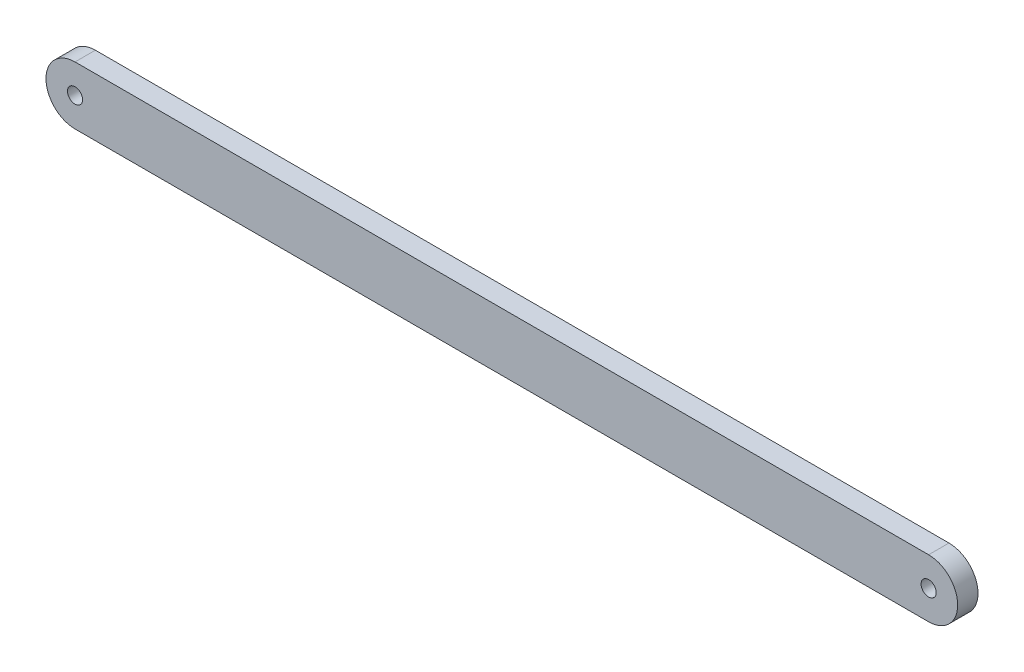
from build123d import *

# Parameters (mm, degrees)
SKETCH_1_R      = 2.6
EXTRUDE_1_DEPTH = 7


with BuildPart() as part:
    # 草图1 → 凸台-拉伸1 (new body)
    with BuildSketch(Plane.XY):
        with BuildLine():
            Line((0, 10), (293.96, 10))
            ThreePointArc((293.96, 10), (303.96, 0), (293.96, -10))
            Line((293.96, -10), (0, -10))
            ThreePointArc((0, -10), (-10, 0), (0, 10))
        make_face()
        Circle(SKETCH_1_R, mode=Mode.SUBTRACT)
        with Locations((293.96, 0)):
            Circle(SKETCH_1_R, mode=Mode.SUBTRACT)
    extrude(amount=EXTRUDE_1_DEPTH)


solid = part.part
